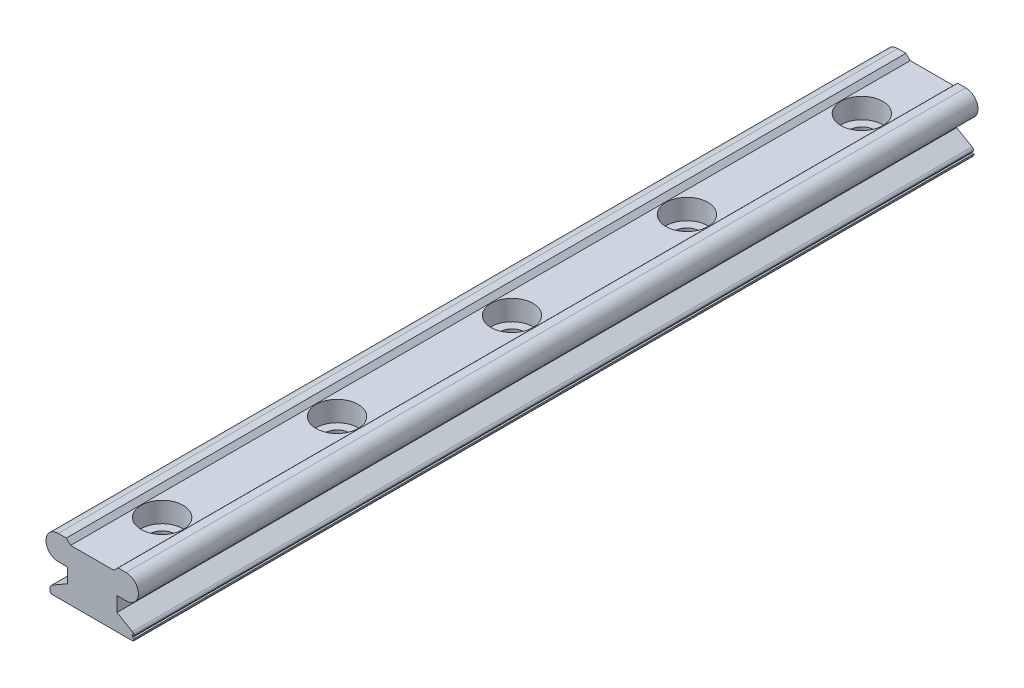
from build123d import *

# Parameters (mm, degrees)
BOSS_EXTRUDE1_DEPTH     = 60
CUT_EXTRUDE1_DEPTH      = 61.889736409
CUT_EXTRUDE1_DEPTH_BACK = 61.889736409
SKETCH4_W               = 0.254
SKETCH4_H               = 0.381
LPATTERN2_COUNT         = 5
LPATTERN2_PITCH         = 25


with BuildPart() as part:
    # Sketch1 → Boss-Extrude1 (new, symmetric)
    with BuildSketch(Plane.XY):
        with BuildLine():
            Line((-4.85, 8), (-3.7, 8))
            Line((-3.7, 8), (-3.078681812, 7.4))
            Line((-3.078681812, 7.4), (3.078681812, 7.4))
            Line((3.078681812, 7.4), (3.7, 8))
            Line((3.7, 8), (4.85, 8))
            ThreePointArc((4.85, 8), (6.6, 6.25), (4.85, 4.5))
            Line((4.85, 4.5), (3.55, 4.5))
            Line((3.55, 4.5), (3.55, 2.41450816))
            Line((3.55, 2.41450816), (5.746, 1.146646968))
            ThreePointArc((5.746, 1.146646968), (5.931940905, 0.960706063), (6, 0.706706063))
            Line((6, 0.706706063), (6, 0.254))
            ThreePointArc((6, 0.254), (5.925605122, 0.074394878), (5.746, 0))
            Line((5.746, 0), (-5.746, 0))
            ThreePointArc((-5.746, 0), (-5.925605122, 0.074394878), (-6, 0.254))
            Line((-6, 0.254), (-6, 0.706706063))
            ThreePointArc((-6, 0.706706063), (-5.931940905, 0.960706063), (-5.746, 1.146646968))
            Line((-5.746, 1.146646968), (-3.55, 2.41450816))
            Line((-3.55, 2.41450816), (-3.55, 4.5))
            Line((-3.55, 4.5), (-4.85, 4.5))
            ThreePointArc((-4.85, 4.5), (-6.6, 6.25), (-4.85, 8))
        make_face()
    extrude(amount=BOSS_EXTRUDE1_DEPTH, both=True)

    # Sketch4 → Cut-Extrude1 (cut, two sides: drawn at the far end of the back side and taken through both)
    with BuildSketch(Plane.XY.offset(-CUT_EXTRUDE1_DEPTH_BACK)):
        with Locations((5.873, 0.5969)):
            Rectangle(SKETCH4_W, SKETCH4_H)
    extrude(amount=CUT_EXTRUDE1_DEPTH + CUT_EXTRUDE1_DEPTH_BACK, mode=Mode.SUBTRACT)

    # Sketch2 → Cut-Revolve1 (revolve, cut)
    with BuildSketch(Plane(origin=(0, 0, 0), x_dir=(0, 0, -1), z_dir=(1, 0, 0)), mode=Mode.PRIVATE) as cut_revolve1_sk:
        Polygon((-53, 7.4), (-53, 4.5), (-51.75, 4.5), (-51.75, 0), (-50, 0), (-50, 7.4), (-50, 8), (-53, 8), align=None)
    cut_revolve1 = revolve(cut_revolve1_sk.sketch.rotate(Axis((0, 0, 50), (0, 1, 0)), 180), axis=Axis((0, 0, 50), (0, 1, 0)), mode=Mode.SUBTRACT)

    # LPattern2: Cut-Revolve1 ×5
    with Locations(*[(0, 0, -i * LPATTERN2_PITCH) for i in range(1, LPATTERN2_COUNT)]):
        add(cut_revolve1, mode=Mode.SUBTRACT)


solid = part.part
